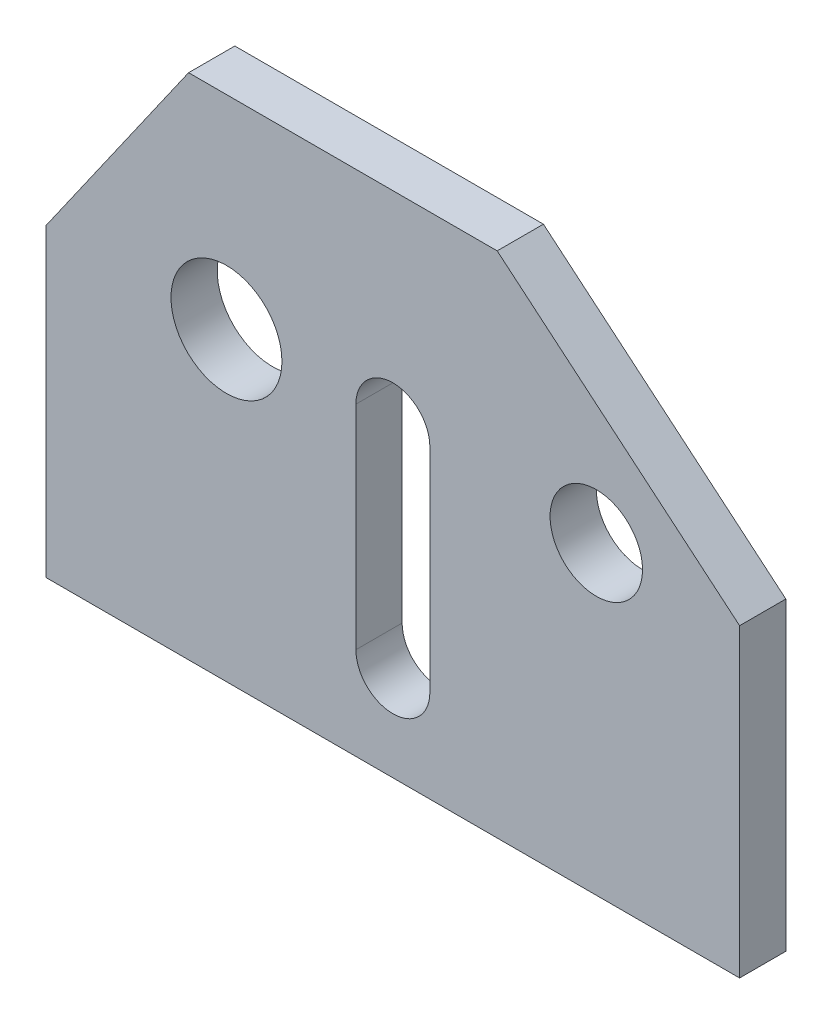
from build123d import *

# Parameters (mm, degrees)
SKETCH1_R           = 6
SKETCH1_R_2         = 5
BOSS_EXTRUDE1_DEPTH = 5


with BuildPart() as part:
    # Sketch1 → Boss-Extrude1 (new body)
    with BuildSketch(Plane.XY):
        Polygon((0, 0), (75, 0), (75, 33), (48.781420963, 55), (15.404565841, 55), (0, 33), align=None)
        with Locations((19.5, 33)):
            Circle(SKETCH1_R, mode=Mode.SUBTRACT)
        with Locations((59.5, 33)):
            Circle(SKETCH1_R_2, mode=Mode.SUBTRACT)
        with BuildLine():
            Line((33.5, 33), (33.5, 10))
            ThreePointArc((33.5, 10), (37.5, 6), (41.5, 10))
            Line((41.5, 10), (41.5, 33))
            ThreePointArc((41.5, 33), (37.5, 37), (33.5, 33))
        make_face(mode=Mode.SUBTRACT)
    extrude(amount=BOSS_EXTRUDE1_DEPTH)


solid = part.part
